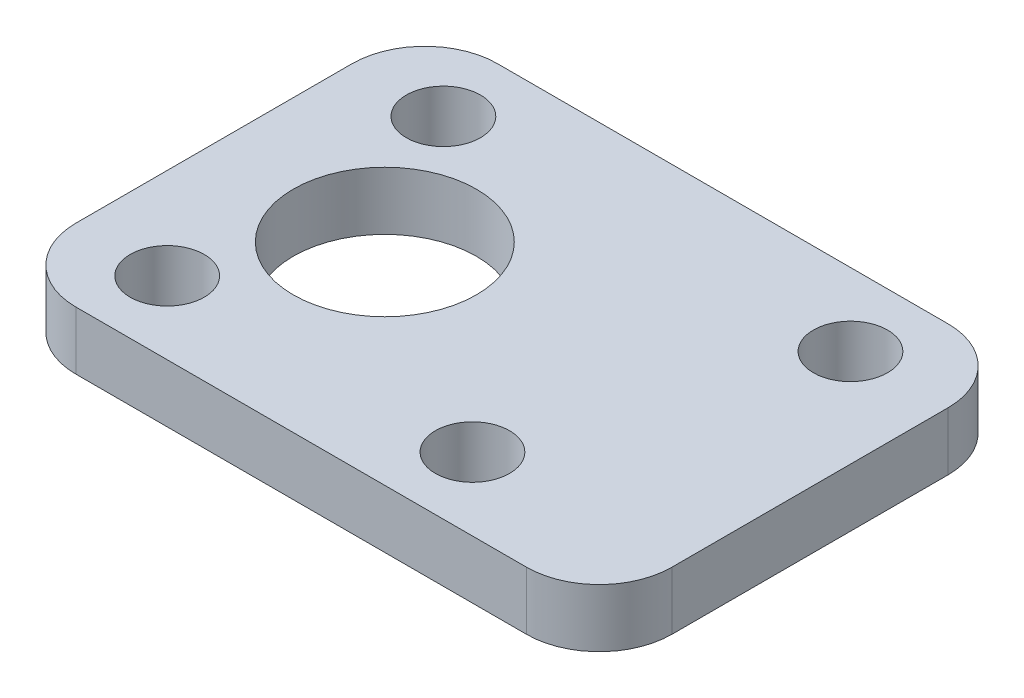
from build123d import *

# Parameters (mm, degrees)
SKETCH1_W           = 82
SKETCH1_H           = 58
SKETCH1_R           = 12.6
SKETCH1_R_2         = 5.1
BOSS_EXTRUDE1_DEPTH = 8
FILLET1_R           = 10


with BuildPart() as part:
    # Sketch1 → Boss-Extrude1 (new body)
    with BuildSketch(Plane(origin=(0, 0, 0), x_dir=(1, 0, 0), z_dir=(0, 1, 0))):
        with Locations((41, 29)):
            Rectangle(SKETCH1_W, SKETCH1_H)
        with Locations(Location((23.5, 29, 0), (0, 0, 270))):
            Circle(SKETCH1_R, mode=Mode.SUBTRACT)
        with Locations(Location((68.57, 48, 0), (0, 0, 270))):
            Circle(SKETCH1_R_2, mode=Mode.SUBTRACT)
        with Locations(Location((54.561074274, 10, 0), (0, 0, 270))):
            Circle(SKETCH1_R_2, mode=Mode.SUBTRACT)
        with Locations(Location((12.561074274, 10, 0), (0, 0, 270))):
            Circle(SKETCH1_R_2, mode=Mode.SUBTRACT)
        with Locations(Location((12.561074274, 48, 0), (0, 0, 270))):
            Circle(SKETCH1_R_2, mode=Mode.SUBTRACT)
    extrude(amount=BOSS_EXTRUDE1_DEPTH)

    # Fillet1
    fillet1_edges = [part.edges().sort_by_distance(p)[0] for p in [
        (0, 4, 0),
        (0, 4, -58),
        (82, 4, -58),
        (82, 4, 0),
    ]]
    fillet(fillet1_edges, radius=FILLET1_R)


solid = part.part
